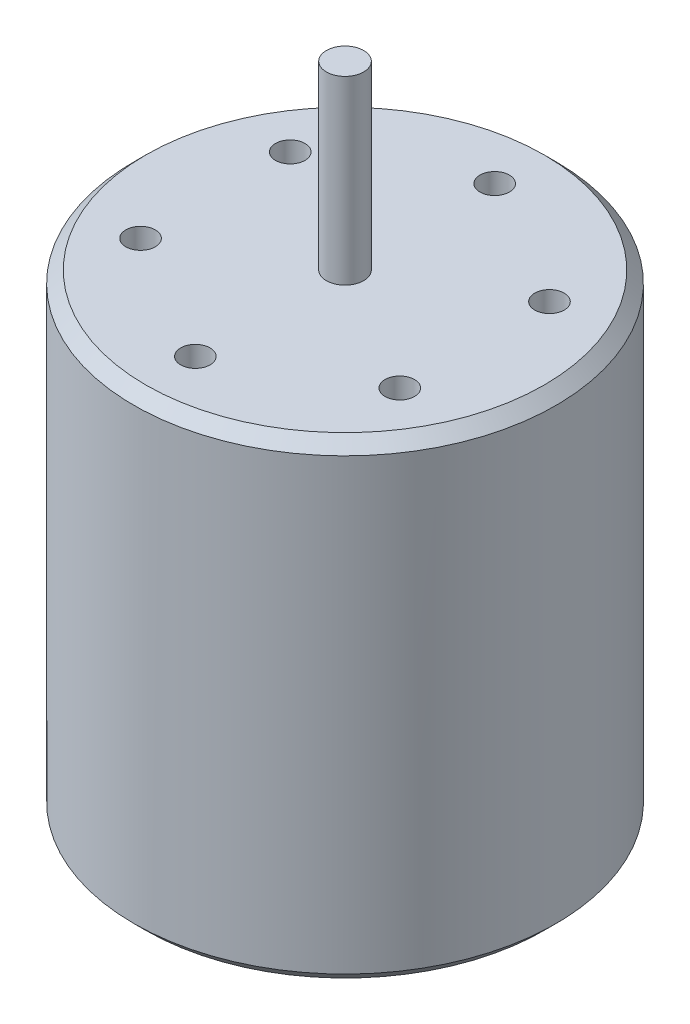
from build123d import *

# Parameters (mm, degrees)
SKETCH1_R                           = 17.907
BOSS_EXTRUDE1_DEPTH                 = 40.0812
M3X0_5_BOTTOMING_TAPPED_HOLE1_D     = 2.5
M3X0_5_BOTTOMING_TAPPED_HOLE1_DEPTH = 5
M3X0_5_BOTTOMING_TAPPED_HOLE1_TIP   = 0.751075774
SKETCH4_R                           = 1.58
BOSS_EXTRUDE2_DEPTH                 = 15.3416
CHAMFER1_SIZE                       = 1


with BuildPart() as part:
    # Sketch1 → Boss-Extrude1 (new body)
    with BuildSketch(Plane(origin=(0, 0, 0), x_dir=(1, 0, 0), z_dir=(0, 1, 0))):
        with Locations(Location((0, 0, 0), (0, 0, 90))):
            Circle(SKETCH1_R)
    extrude(amount=BOSS_EXTRUDE1_DEPTH)

    # M3x0.5 Bottoming Tapped Hole1
    with Locations(Plane(origin=(0, 40.0812, 0), x_dir=(1, 0, 0), z_dir=(0, 1, 0))):
        with Locations((0, 12.7), (10.998522628, 6.35), (10.998522628, -6.35), (0, -12.7), (-10.998522628, -6.35), (-10.998522628, 6.35)):
            Hole(M3X0_5_BOTTOMING_TAPPED_HOLE1_D / 2, depth=M3X0_5_BOTTOMING_TAPPED_HOLE1_DEPTH)
            with Locations((0, 0, -(M3X0_5_BOTTOMING_TAPPED_HOLE1_DEPTH + M3X0_5_BOTTOMING_TAPPED_HOLE1_TIP / 2))):  # 118° drill point
                Cone(0, M3X0_5_BOTTOMING_TAPPED_HOLE1_D / 2, M3X0_5_BOTTOMING_TAPPED_HOLE1_TIP, mode=Mode.SUBTRACT)

    # Sketch4 → Boss-Extrude2 (add)
    with BuildSketch(Plane(origin=(0, 40.0812, 0), x_dir=(1, 0, 0), z_dir=(0, 1, 0))):
        with Locations(Location((0, 0, 0), (0, 0, 270))):
            Circle(SKETCH4_R)
    extrude(amount=BOSS_EXTRUDE2_DEPTH)

    # Chamfer1
    chamfer1_edges = [part.edges().sort_by_distance(p)[0] for p in [
        (0, 0, 17.907),
        (0, 40.0812, 17.907),
    ]]
    chamfer(chamfer1_edges, length=CHAMFER1_SIZE)


solid = part.part
